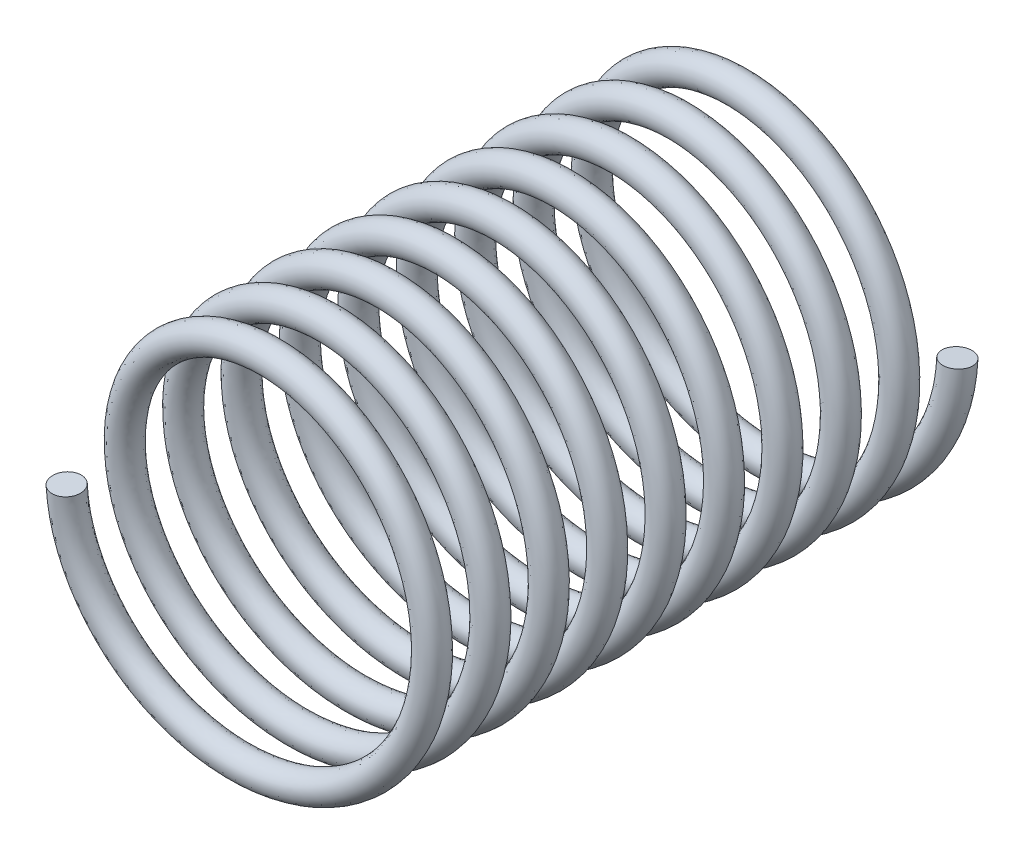
from build123d import *

# Parameters (mm, degrees)
T_HNOUT_PO_K_IVCE1_PITCH     = 2
T_HNOUT_PO_K_IVCE1_HEIGHT    = 19
T_HNOUT_PO_K_IVCE1_RADIUS    = 5.75
T_HNOUT_PO_K_IVCE1_PROFILE_R = 0.5


with BuildPart() as part:
    # Táhnout po křivce1: sweep along a helix
    with BuildLine() as t_hnout_po_k_ivce1_path:
        Helix(T_HNOUT_PO_K_IVCE1_PITCH, T_HNOUT_PO_K_IVCE1_HEIGHT, T_HNOUT_PO_K_IVCE1_RADIUS, center=(0, 0, 0), direction=(0, 0, 1), lefthand=True)
    # Táhnout po křivce1 profile (on start of the path) → Táhnout po křivce1 (sweep)
    with BuildSketch(Plane(origin=(5.75, 0, 0), x_dir=(0, -0.05527361190804904, -0.9984712453679567), z_dir=(-3.355898462257719e-13, -0.9984712453679567, 0.05527361190804904))):
        Circle(T_HNOUT_PO_K_IVCE1_PROFILE_R)
    sweep(path=t_hnout_po_k_ivce1_path.line, is_frenet=True)


solid = part.part
